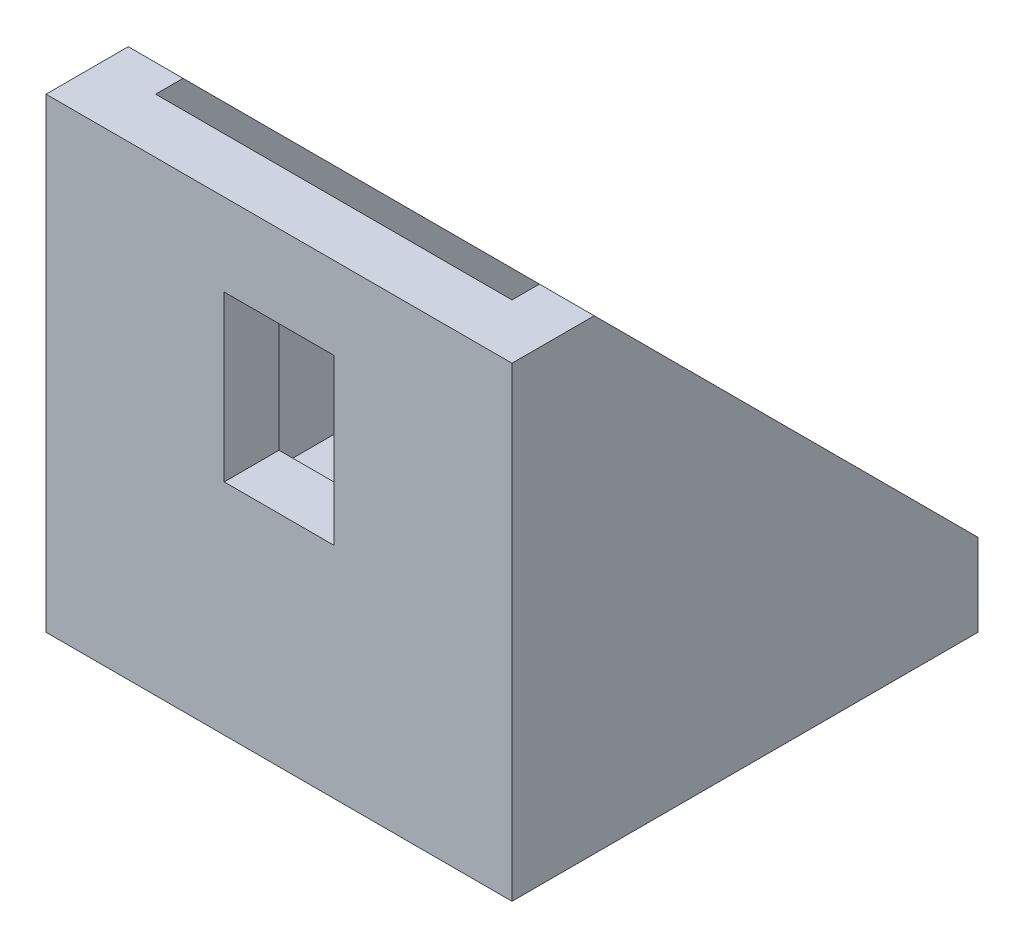
from build123d import *

# Parameters (mm, degrees)
BODY_DEPTH     = 8.5
SKETCH2_W      = 13
SKETCH2_H      = 14
EXTUSION_DEPTH = 15
SKETCH3_W      = 4
SKETCH3_H      = 6
HOLE_A_DEPTH   = 25.212600026
SKETCH4_W      = 4
SKETCH4_H      = 6
HOLE_B_DEPTH   = 17


with BuildPart() as part:
    # Sketch1 → Body (new, symmetric)
    with BuildSketch(Plane(origin=(0, 0, 0), x_dir=(0, 0, -1), z_dir=(1, 0, 0))):
        Polygon((3, 17), (0, 17), (0, 0), (17, 0), (17, 3), align=None)
    extrude(amount=BODY_DEPTH, both=True)

    # Sketch2 → Extusion (cut)
    with BuildSketch(Plane(origin=(0, 0, -17), x_dir=(-1, 0, 0), z_dir=(0, 0, -1))):
        with Locations((0, 10)):
            Rectangle(SKETCH2_W, SKETCH2_H)
    extrude(amount=-EXTUSION_DEPTH, mode=Mode.SUBTRACT)

    # Sketch3 → Hole_A (cut, through all)
    with BuildSketch(Plane(origin=(0, 0, -2), x_dir=(-1, 0, 0), z_dir=(0, 0, -1))):
        with Locations((0, 11)):
            Rectangle(SKETCH3_W, SKETCH3_H)
    extrude(amount=-HOLE_A_DEPTH, mode=Mode.SUBTRACT)

    # Sketch4 → Hole_B (cut)
    with BuildSketch(Plane(origin=(0, 3, 0), x_dir=(1, 0, 0), z_dir=(0, 1, 0))):
        with Locations((0, 11)):
            Rectangle(SKETCH4_W, SKETCH4_H)
    extrude(amount=-HOLE_B_DEPTH, mode=Mode.SUBTRACT)


solid = part.part
